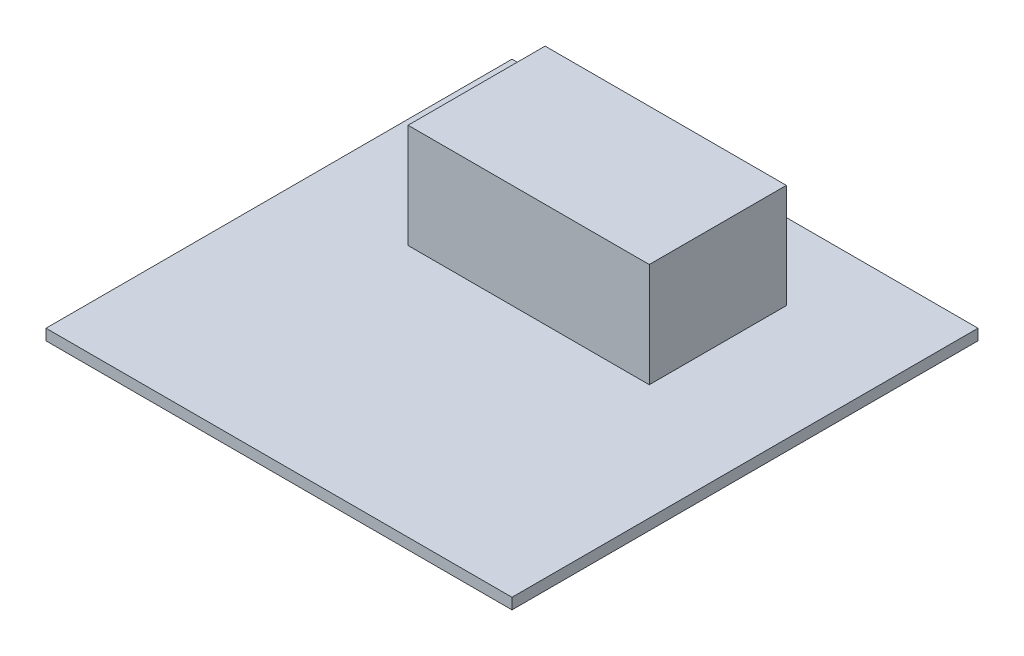
from build123d import *

# Parameters (mm, degrees)
SKETCH1_W           = 170
SKETCH1_H           = 170
BOSS_EXTRUDE1_DEPTH = 4
SKETCH2_W           = 88
SKETCH2_H           = 50
BOSS_EXTRUDE2_DEPTH = 38


with BuildPart() as part:
    # Sketch1 → Boss-Extrude1 (new body)
    with BuildSketch(Plane(origin=(0, 0, 0), x_dir=(1, 0, 0), z_dir=(0, 1, 0))):
        with Locations((85, -85)):
            Rectangle(SKETCH1_W, SKETCH1_H)
    extrude(amount=BOSS_EXTRUDE1_DEPTH)

    # Sketch2 → Boss-Extrude2 (add)
    with BuildSketch(Plane(origin=(0, 4, 0), x_dir=(1, 0, 0), z_dir=(0, 1, 0))):
        with Locations((83.912390146, -52.831121656)):
            Rectangle(SKETCH2_W, SKETCH2_H)
    extrude(amount=BOSS_EXTRUDE2_DEPTH)


solid = part.part
